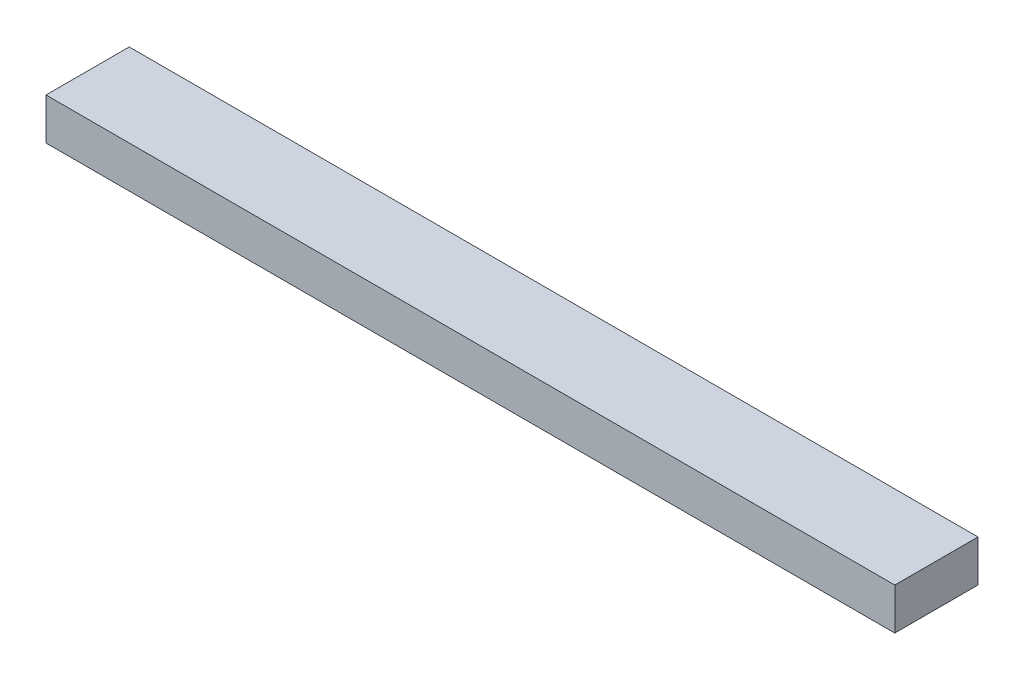
from build123d import *

# Parameters (mm, degrees)
SKETCH_1_W      = 101.987252732
SKETCH_1_H      = 10
EXTRUDE_1_DEPTH = 5


with BuildPart() as part:
    # 草图1 → 凸台-拉伸1 (new body)
    with BuildSketch(Plane(origin=(0, 0, 0), x_dir=(1, 0, 0), z_dir=(0, 1, 0))):
        with Locations((50.993626366, -5)):
            Rectangle(SKETCH_1_W, SKETCH_1_H)
    extrude(amount=EXTRUDE_1_DEPTH)


solid = part.part
